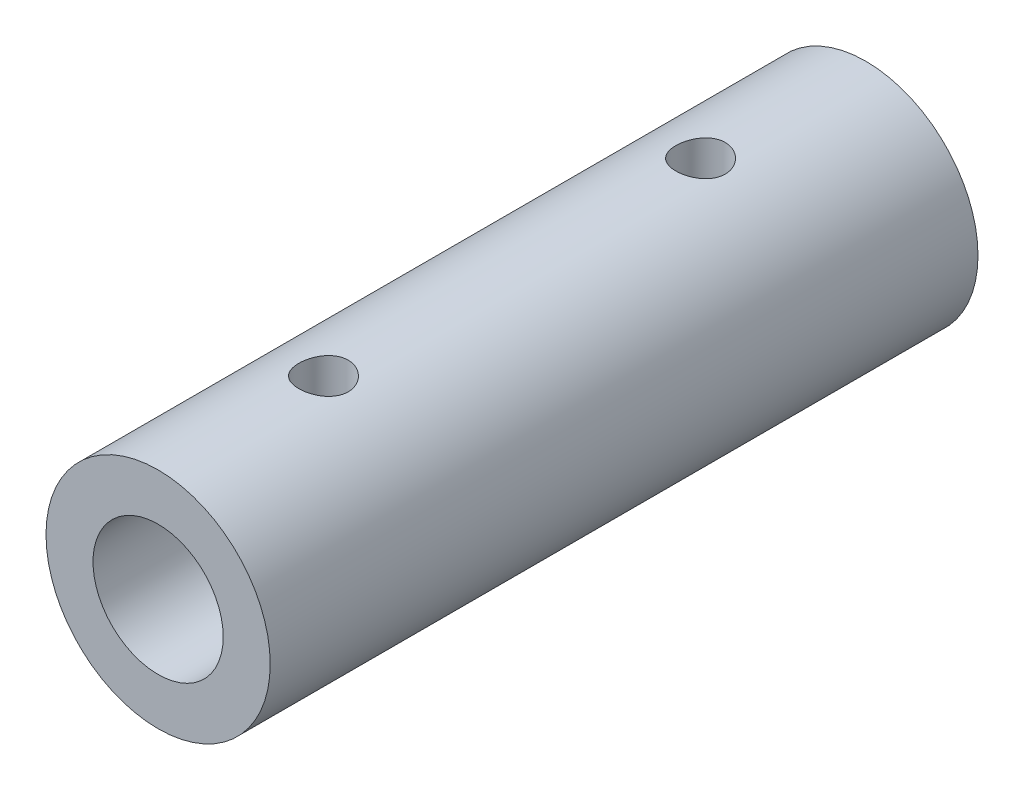
from build123d import *

# Parameters (mm, degrees)
SKETCH1_R                       = 8.610000052
SKETCH1_R_2                     = 4.999999906
BOSS_EXTRUDE1_DEPTH             = 54.356
SKETCH2_W                       = 1.89865
SKETCH2_H                       = 8.610000052
F_10_24_TAPPED_HOLE1_AT_2_COUNT = 2
F_10_24_TAPPED_HOLE1_AT_2_PITCH = 28.956
SKETCH8_W                       = 2.45745
SKETCH8_H                       = 8.610000052


with BuildPart() as part:
    # Sketch1 → Boss-Extrude1 (new body)
    with BuildSketch(Plane.XY):
        Circle(SKETCH1_R)
        Circle(SKETCH1_R_2, mode=Mode.SUBTRACT)
    extrude(amount=BOSS_EXTRUDE1_DEPTH)

    # Sketch2 → #10-24 Tapped Hole1 (revolve, cut)
    with BuildSketch(Plane(origin=(0, 0, 12.7), x_dir=(0, 0, -1), z_dir=(1, 0, 0))):
        with Locations((0.949325, 4.305000026)):
            Rectangle(SKETCH2_W, SKETCH2_H)
    f_10_24_tapped_hole1 = revolve(axis=Axis((0, -6.35, 12.7), (0, 1, 0)), mode=Mode.SUBTRACT)

    # #10-24 Tapped Hole1 at 2: #10-24 Tapped Hole1 ×2
    with Locations(*[(0, 0, i * F_10_24_TAPPED_HOLE1_AT_2_PITCH) for i in range(1, F_10_24_TAPPED_HOLE1_AT_2_COUNT)]):
        add(f_10_24_tapped_hole1, mode=Mode.SUBTRACT)

    # Sketch8 → #10 (0.1935) Diameter Hole3 (revolve, cut)
    with BuildSketch(Plane(origin=(0, 0, 41.656), x_dir=(0, 0, 1), z_dir=(1, 0, 0))):
        with Locations((1.228725, 4.305000026)):
            Rectangle(SKETCH8_W, SKETCH8_H)
    revolve(axis=Axis((0, 6.35, 41.656), (0, -1, 0)), mode=Mode.SUBTRACT)


solid = part.part
